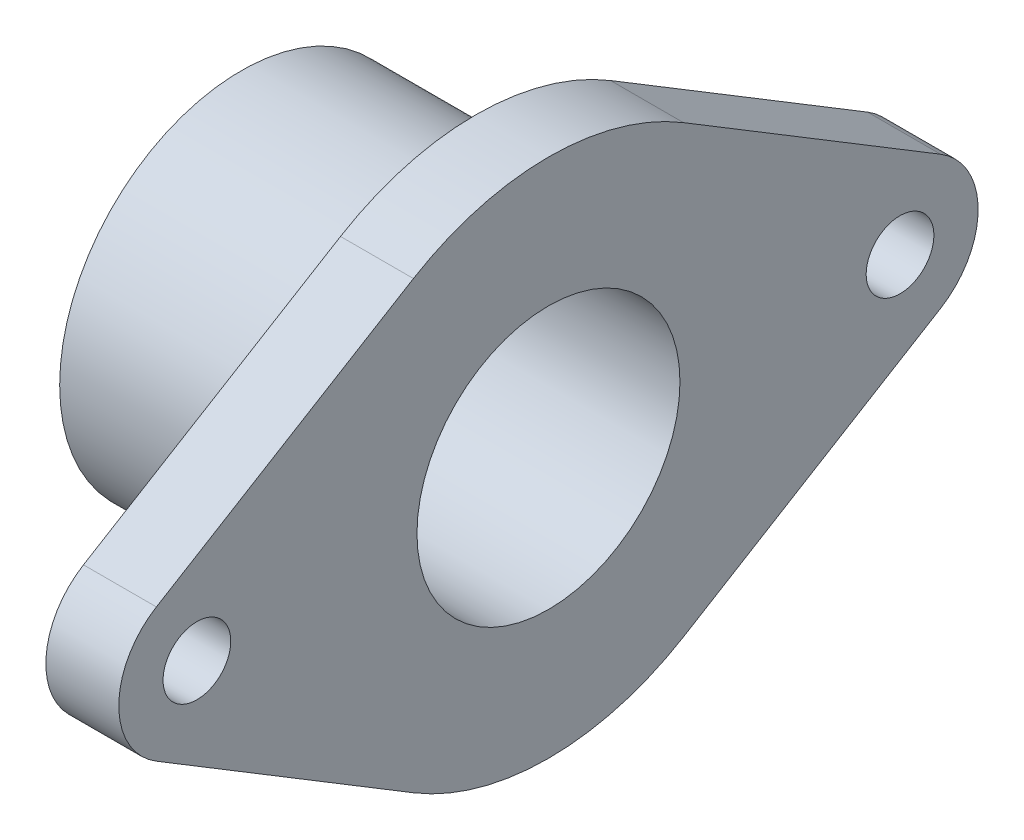
from build123d import *

# Parameters (mm, degrees)
BOSS_EXTRUDE1_DEPTH = 14
SKETCH2_R           = 6.5
CUT_EXTRUDE1_DEPTH  = 98.479485021
SKETCH3_R           = 25.25
CUT_EXTRUDE2_DEPTH  = 98.479485021
BOSS_EXTRUDE2_START = 45
SKETCH4_R           = 34.85
SKETCH4_R_2         = 25.25
BOSS_EXTRUDE2_DEPTH = 45


with BuildPart() as part:
    # Sketch1 → Boss-Extrude1 (new body)
    with BuildSketch(Plane(origin=(0, 0, 0), x_dir=(0, 0, -1), z_dir=(1, 0, 0))):
        with BuildLine():
            Line((-25.925925926, 42.753319928), (-75.277777778, 12.825995978))
            ThreePointArc((-75.277777778, 12.825995978), (-82.5, 0), (-75.277777778, -12.825995978))
            Line((-75.277777778, -12.825995978), (-25.925925926, -42.753319928))
            ThreePointArc((-25.925925926, -42.753319928), (0, -50), (25.925925926, -42.753319928))
            Line((25.925925926, -42.753319928), (75.277777778, -12.825995978))
            ThreePointArc((75.277777778, -12.825995978), (82.5, 0), (75.277777778, 12.825995978))
            Line((75.277777778, 12.825995978), (25.925925926, 42.753319928))
            ThreePointArc((25.925925926, 42.753319928), (0, 50), (-25.925925926, 42.753319928))
        make_face()
    extrude(amount=BOSS_EXTRUDE1_DEPTH)

    # Sketch2 → Cut-Extrude1 (cut, through all)
    with BuildSketch(Plane.ZY):
        with Locations((67.5, 0)):
            Circle(SKETCH2_R)
        with Locations((-67.5, 0)):
            Circle(SKETCH2_R)
    extrude(amount=-CUT_EXTRUDE1_DEPTH, mode=Mode.SUBTRACT)

    # Sketch3 → Cut-Extrude2 (cut, through all)
    with BuildSketch(Plane.ZY):
        Circle(SKETCH3_R)
    extrude(amount=-CUT_EXTRUDE2_DEPTH, mode=Mode.SUBTRACT)

    # Sketch4 → Boss-Extrude2 (add)
    with BuildSketch(Plane.ZY.offset(BOSS_EXTRUDE2_START)):
        with Locations(Location((0, 0, 0), (0, 0, 180))):
            Circle(SKETCH4_R)
        Circle(SKETCH4_R_2, mode=Mode.SUBTRACT)
    extrude(amount=-BOSS_EXTRUDE2_DEPTH)

    # Sketch5 → Revolve1 (revolve)
    with BuildSketch(Plane(origin=(0, 0, 0), x_dir=(1, 0, 0), z_dir=(0, 1, 0))):
        Polygon((0, 34.85), (-5, 34.85), (0, 41.85), align=None)
    revolve(axis=Axis((0, 0, 0), (-1, 0, 0)))


solid = part.part
